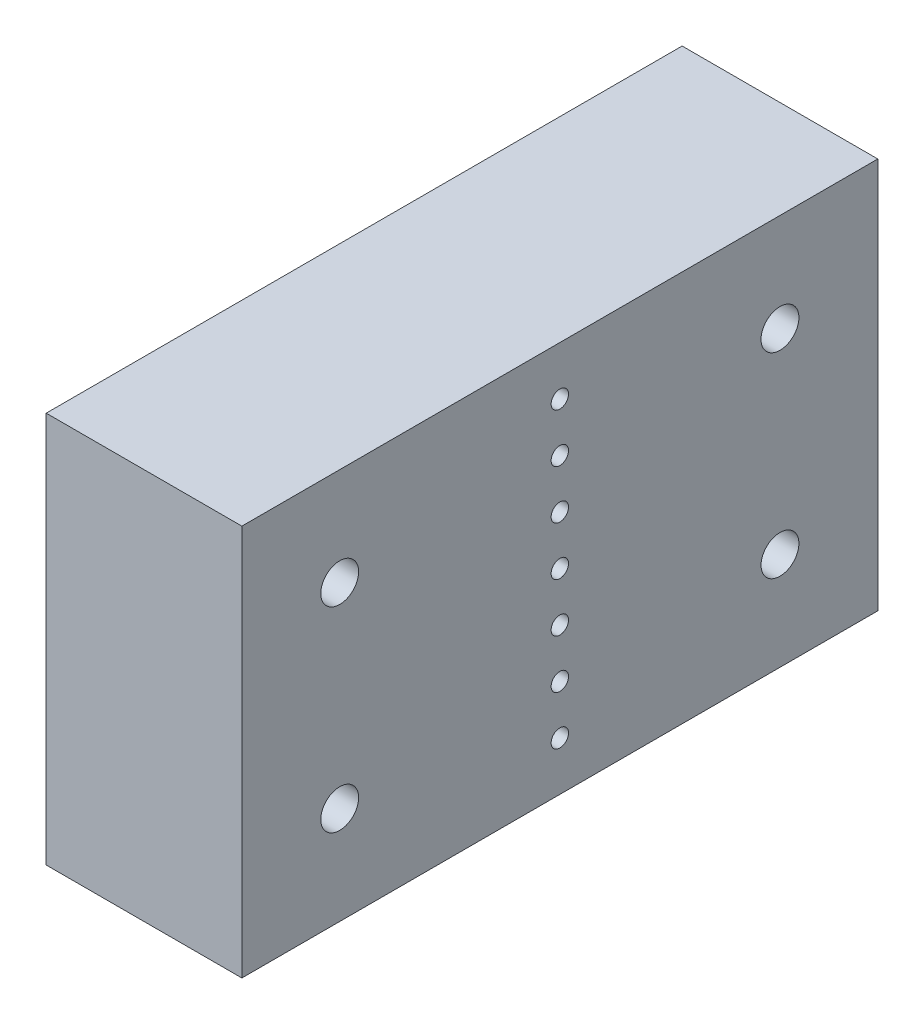
from build123d import *

# Parameters (mm, degrees)
SKETCH1_W                    = 82.55
SKETCH1_H                    = 50.8
BOSS_EXTRUDE1_DEPTH          = 12.7
F_10_0_1935_DIAMETER_HOLE1_D = 4.9149
F_4_40_TAPPED_HOLE1_D        = 2.2606


with BuildPart() as part:
    # Sketch1 → Boss-Extrude1 (new, symmetric)
    with BuildSketch(Plane(origin=(0, 0, 0), x_dir=(0, 0, -1), z_dir=(1, 0, 0))):
        Rectangle(SKETCH1_W, SKETCH1_H)
    extrude(amount=BOSS_EXTRUDE1_DEPTH, both=True)

    # #10 (0.1935) Diameter Hole1 (through all)
    with Locations(Plane(origin=(12.7, 0, 0), x_dir=(0, 0, -1), z_dir=(1, 0, 0))):
        with Locations((28.575, 12.7), (-28.575, 12.7), (-28.575, -12.7), (28.575, -12.7)):
            Hole(F_10_0_1935_DIAMETER_HOLE1_D / 2)

    # #4-40 Tapped Hole1 (through all)
    with Locations(Plane(origin=(12.7, 0, 0), x_dir=(0, 0, -1), z_dir=(1, 0, 0))):
        with Locations((0, 19.05), (0, 12.7), (0, 6.35), (0, 0), (0, -6.35), (0, -12.7), (0, -19.05)):
            Hole(F_4_40_TAPPED_HOLE1_D / 2)


solid = part.part
